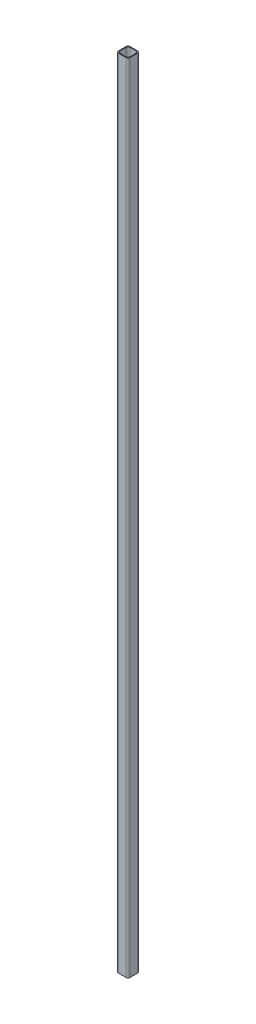
from build123d import *

# Parameters (mm, degrees)
EXTRUDE_1_DEPTH = 4120


with BuildPart() as part:
    # Эскиз1 → Бобышка-Вытянуть1 (new body)
    with BuildSketch(Plane(origin=(0, 0, 0), x_dir=(1, 0, 0), z_dir=(0, 1, 0))):
        with BuildLine():
            Line((-20, 30), (20, 30))
            ThreePointArc((20, 30), (27.071067812, 27.071067812), (30, 20))
            Line((30, 20), (30, -20))
            ThreePointArc((30, -20), (27.071067812, -27.071067812), (20, -30))
            Line((20, -30), (-20, -30))
            ThreePointArc((-20, -30), (-27.071067812, -27.071067812), (-30, -20))
            Line((-30, -20), (-30, 20))
            ThreePointArc((-30, 20), (-27.071067812, 27.071067812), (-20, 30))
        make_face()
        with BuildLine():
            Line((-16, 26), (16, 26))
            ThreePointArc((16, 26), (23.071067812, 23.071067812), (26, 16))
            Line((26, 16), (26, -16))
            ThreePointArc((26, -16), (23.071067812, -23.071067812), (16, -26))
            Line((16, -26), (-16, -26))
            ThreePointArc((-16, -26), (-23.071067812, -23.071067812), (-26, -16))
            Line((-26, -16), (-26, 16))
            ThreePointArc((-26, 16), (-23.071067812, 23.071067812), (-16, 26))
        make_face(mode=Mode.SUBTRACT)
    extrude(amount=EXTRUDE_1_DEPTH)


solid = part.part
